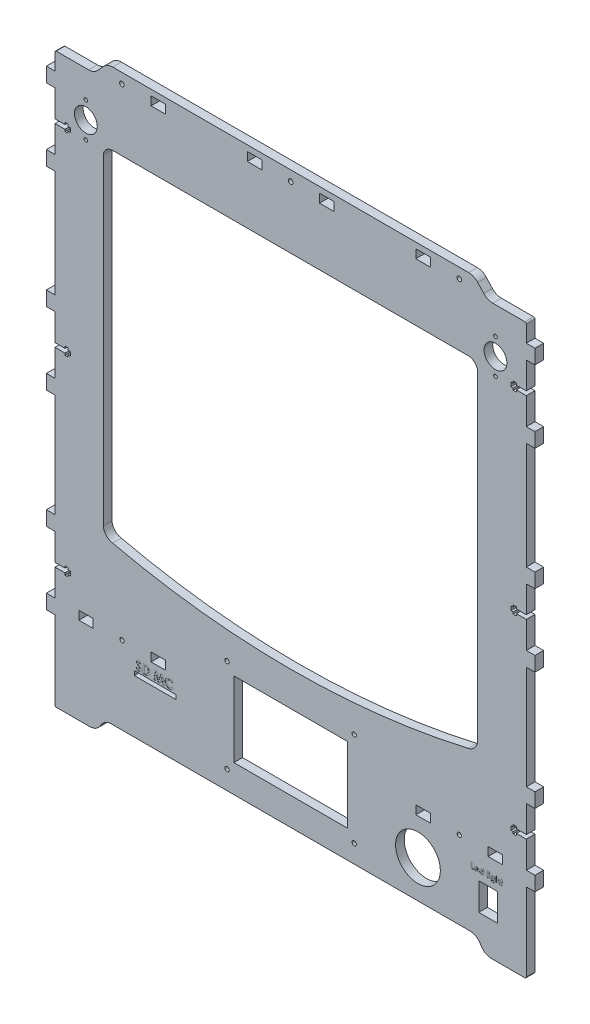
from build123d import *

# Parameters (mm, degrees)
SKETCH_1_R          = 1.5
SKETCH_1_R_2        = 15.5
SKETCH_1_R_3        = 1.6
SKETCH_1_R_4        = 7.9
SKETCH_1_R_5        = 1.25
SKETCH_1_W          = 10
SKETCH_1_H          = 6
SKETCH_1_W_2        = 78.6
SKETCH_1_H_2        = 51.99959895
SKETCH_1_W_3        = 13
SKETCH_1_H_3        = 19
SKETCH_1_W_4        = 29
SKETCH_1_H_4        = 3
EXTRUDE_2_DEPTH     = 6
CUT_EXTRUDE_2_DEPTH = 0.1
SKETCH_4_W          = 0.717948718
SKETCH_4_H          = 4.102564103
SKETCH_4_H_2        = 2.923076923
CUT_EXTRUDE_3_DEPTH = 0.1


with BuildPart() as part:
    # Эскиз1 → Бобышка-Вытянуть2 (new body)
    with BuildSketch(Plane.XY):
        with BuildLine():
            Line((-162.349245127, -146.930877786), (-168.354558228, -146.930877786))
            Line((-168.354558228, -146.930877786), (-168.354558228, -136.930877786))
            Line((-168.354558228, -136.930877786), (-162.354558228, -136.930877786))
            Line((-162.354558228, -136.930877786), (-162.354558228, -118.320877786))
            Line((-162.354558228, -118.320877786), (-155.442615928, -118.320877786))
            Line((-155.442615928, -118.320877786), (-155.442615928, -119.72098181))
            Line((-155.442615928, -119.72098181), (-153.241793345, -119.72098181))
            Line((-153.241793345, -119.72098181), (-153.241793345, -118.321100605))
            Line((-153.241793345, -118.321100605), (-151.743644127, -118.321100605))
            Line((-151.743644127, -118.321100605), (-151.743644127, -115.521795283))
            Line((-151.743644127, -115.521795283), (-153.245115684, -115.521795283))
            Line((-153.245115684, -115.521795283), (-153.245115684, -114.120877786))
            Line((-153.245115684, -114.120877786), (-155.445116095, -114.120877786))
            Line((-155.445116095, -114.120877786), (-155.445116095, -115.520877786))
            Line((-155.445116095, -115.520877786), (-162.354558228, -115.520877786))
            Line((-162.354558228, -115.520877786), (-162.354558228, -96.940877786))
            Line((-162.354558228, -96.940877786), (-168.354558228, -96.940877786))
            Line((-168.354558228, -96.940877786), (-168.354558228, -86.940877786))
            Line((-168.354558228, -86.940877786), (-162.354558228, -86.940877786))
            Line((-162.354558228, -86.940877786), (-162.354558228, -15.210877786))
            Line((-162.354558228, -15.210877786), (-168.354558228, -15.210877786))
            Line((-168.354558228, -15.210877786), (-168.354558228, -5.210877786))
            Line((-168.354558228, -5.210877786), (-162.354558228, -5.210877786))
            Line((-162.354558228, -5.210877786), (-162.354558228, 13.389122214))
            Line((-162.354558228, 13.389122214), (-155.444055652, 13.389122214))
            Line((-155.444055652, 13.389122214), (-155.444055652, 11.989017706))
            Line((-155.444055652, 11.989017706), (-153.243233069, 11.989017706))
            Line((-153.243233069, 11.989017706), (-153.243233069, 13.362239479))
            Line((-153.243233069, 13.362239479), (-151.742761748, 13.362239479))
            Line((-151.742761748, 13.362239479), (-151.742761748, 16.188530845))
            Line((-151.742761748, 16.188530845), (-153.245115684, 16.188530845))
            Line((-153.245115684, 16.188530845), (-153.245115684, 17.589122214))
            Line((-153.245115684, 17.589122214), (-155.445116095, 17.589122214))
            Line((-155.445116095, 17.589122214), (-155.445116095, 16.189122214))
            Line((-155.445116095, 16.189122214), (-162.354558228, 16.189122214))
            Line((-162.354558228, 16.189122214), (-162.354558228, 34.789122214))
            Line((-162.354558228, 34.789122214), (-168.354558228, 34.789122214))
            Line((-168.354558228, 34.789122214), (-168.354558228, 44.789122214))
            Line((-168.354558228, 44.789122214), (-162.354558228, 44.789122214))
            Line((-162.354558228, 44.789122214), (-162.354558228, 118.949122214))
            Line((-162.354558228, 118.949122214), (-168.354558228, 118.949122214))
            Line((-168.354558228, 118.949122214), (-168.354558228, 128.949122214))
            Line((-168.354558228, 128.949122214), (-162.354558228, 128.949122214))
            Line((-162.354558228, 128.949122214), (-162.354558228, 147.549122214))
            Line((-162.354558228, 147.549122214), (-155.444087484, 147.549122214))
            Line((-155.444087484, 147.549122214), (-155.444087484, 146.149017702))
            Line((-155.444087484, 146.149017702), (-153.243264902, 146.149017702))
            Line((-153.243264902, 146.149017702), (-153.243264902, 147.548898907))
            Line((-153.243264902, 147.548898907), (-151.737469071, 147.548898907))
            Line((-151.737469071, 147.548898907), (-151.737951164, 150.348204717))
            Line((-151.737951164, 150.348204717), (-153.239802583, 150.348204717))
            Line((-153.239802583, 150.348204717), (-153.239802583, 151.749122214))
            Line((-153.239802583, 151.749122214), (-155.439802995, 151.749122214))
            Line((-155.439802995, 151.749122214), (-155.439802995, 150.349122214))
            Line((-155.439802995, 150.349122214), (-162.349245127, 150.349122214))
            Line((-162.349245127, 150.349122214), (-162.349245127, 168.949122214))
            Line((-162.349245127, 168.949122214), (-168.349245127, 168.949122214))
            Line((-168.349245127, 168.949122214), (-168.349245127, 178.949122214))
            Line((-168.349245127, 178.949122214), (-162.349245127, 178.949122214))
            Line((-162.349245127, 178.949122214), (-162.349245127, 190.349122214))
            ThreePointArc((-162.349245127, 190.349122214), (-162.144381362, 191.019766001), (-161.525304034, 191.349122214))
            Line((-161.525304034, 191.349122214), (-139.092392644, 191.349122214))
            ThreePointArc((-139.092392644, 191.349122214), (-135.666701236, 192.070006687), (-132.82207518, 194.110383773))
            Line((-132.82207518, 194.110383773), (-128.724185584, 198.587860655))
            ThreePointArc((-128.724185584, 198.587860655), (-125.879559527, 200.62823774), (-122.453868119, 201.349122214))
            Line((-122.453868119, 201.349122214), (123.955377865, 201.349122214))
            ThreePointArc((123.955377865, 201.349122214), (127.381069274, 200.62823774), (130.22569533, 198.587860655))
            Line((130.22569533, 198.587860655), (134.323584926, 194.110383773))
            ThreePointArc((134.323584926, 194.110383773), (137.168210982, 192.070006687), (140.59390239, 191.349122214))
            Line((140.59390239, 191.349122214), (162.850754873, 191.349122214))
            ThreePointArc((162.850754873, 191.349122214), (163.557861654, 191.056228995), (163.850754873, 190.349122214))
            Line((163.850754873, 190.349122214), (163.850754873, 178.949122214))
            Line((163.850754873, 178.949122214), (169.850754873, 178.949122214))
            Line((169.850754873, 178.949122214), (169.850754873, 168.949122214))
            Line((169.850754873, 168.949122214), (163.850754873, 168.949122214))
            Line((163.850754873, 168.949122214), (163.850754873, 150.349122214))
            Line((163.850754873, 150.349122214), (156.938753666, 150.349122214))
            Line((156.938753666, 150.349122214), (156.938753666, 151.74917383))
            Line((156.938753666, 151.74917383), (154.741012446, 151.74917383))
            Line((154.741012446, 151.74917383), (154.741012446, 150.349292624))
            Line((154.741012446, 150.349292624), (153.241012446, 150.349292624))
            Line((153.241012446, 150.349292624), (153.241012446, 147.550209336))
            Line((153.241012446, 147.550209336), (154.741012446, 147.550209336))
            Line((154.741012446, 147.550209336), (154.741012446, 146.149291839))
            Line((154.741012446, 146.149291839), (156.941736218, 146.149291839))
            Line((156.941736218, 146.149291839), (156.941736218, 147.549122214))
            Line((156.941736218, 147.549122214), (163.851237257, 147.549122214))
            Line((163.851237257, 147.549122214), (163.851237257, 128.949122214))
            Line((163.851237257, 128.949122214), (169.851237081, 128.949122214))
            Line((169.851237081, 128.949122214), (169.851237081, 118.949122214))
            Line((169.851237081, 118.949122214), (163.851237081, 118.949122214))
            Line((163.851237081, 118.949122214), (163.851237081, 44.789122214))
            Line((163.851237081, 44.789122214), (169.851237081, 44.789122214))
            Line((169.851237081, 44.789122214), (169.851237081, 34.789122214))
            Line((169.851237081, 34.789122214), (163.851237081, 34.789122214))
            Line((163.851237081, 34.789122214), (163.851237081, 16.189122214))
            Line((163.851237081, 16.189122214), (156.939202586, 16.189122214))
            Line((156.939202586, 16.189122214), (156.939202586, 17.562103605))
            Line((156.939202586, 17.562103605), (154.739101533, 17.562103605))
            Line((154.739101533, 17.562103605), (154.739101533, 16.189291862))
            Line((154.739101533, 16.189291862), (153.239956889, 16.189291862))
            Line((153.239956889, 16.189291862), (153.239956889, 13.39020884))
            Line((153.239956889, 13.39020884), (154.741461365, 13.39020884))
            Line((154.741461365, 13.39020884), (154.741461365, 11.989291851))
            Line((154.741461365, 11.989291851), (156.941702753, 11.989291851))
            Line((156.941702753, 11.989291851), (156.941702753, 13.389122214))
            Line((156.941702753, 13.389122214), (163.851237081, 13.389122214))
            Line((163.851237081, 13.389122214), (163.851237081, -5.210877786))
            Line((163.851237081, -5.210877786), (169.851237081, -5.210877786))
            Line((169.851237081, -5.210877786), (169.851237081, -15.210877786))
            Line((169.851237081, -15.210877786), (163.851237081, -15.210877786))
            Line((163.851237081, -15.210877786), (163.851237081, -86.940877786))
            Line((163.851237081, -86.940877786), (169.851237081, -86.940877786))
            Line((169.851237081, -86.940877786), (169.851237081, -96.940877786))
            Line((169.851237081, -96.940877786), (163.939237081, -96.940877786))
            Line((163.939237081, -96.940877786), (163.939237081, -115.520877786))
            Line((163.939237081, -115.520877786), (156.93923577, -115.520877786))
            Line((156.93923577, -115.520877786), (156.93923577, -114.122358317))
            Line((156.93923577, -114.122358317), (154.738205666, -114.122358317))
            Line((154.738205666, -114.122358317), (154.738205666, -115.522239523))
            Line((154.738205666, -115.522239523), (153.238413576, -115.522239523))
            Line((153.238413576, -115.522239523), (153.238413576, -118.322187164))
            Line((153.238413576, -118.322187164), (154.740539372, -118.322187164))
            Line((154.740539372, -118.322187164), (154.740539372, -119.723103854))
            Line((154.740539372, -119.723103854), (156.939923762, -119.723103854))
            Line((156.939923762, -119.723103854), (156.939923762, -118.320877786))
            Line((156.939923762, -118.320877786), (163.851344603, -118.320877786))
            Line((163.851344603, -118.320877786), (163.851344603, -136.930877786))
            Line((163.851344603, -136.930877786), (169.845441772, -136.930877786))
            Line((169.845441772, -136.930877786), (169.845441772, -146.930877786))
            Line((169.845441772, -146.930877786), (163.845441772, -146.930877786))
            Line((163.845441772, -146.930877786), (163.845441772, -200.973061911))
            ThreePointArc((163.845441772, -200.973061911), (163.501928515, -201.680136073), (162.762754873, -201.947675896))
            Line((162.762754873, -201.947675896), (139.726369967, -201.947675896))
            ThreePointArc((139.726369967, -201.947675896), (136.178541077, -201.14298723), (133.302992201, -198.914572468))
            Line((133.302992201, -198.914572468), (131.246288055, -195.894919373))
            ThreePointArc((131.246288055, -195.894919373), (128.327165513, -193.654997866), (124.734910288, -192.858614055))
            Line((124.734910288, -192.858614055), (-123.233400542, -192.858614055))
            ThreePointArc((-123.233400542, -192.858614055), (-126.825655767, -193.654997866), (-129.744778309, -195.894919373))
            Line((-129.744778309, -195.894919373), (-131.801482455, -198.914572469))
            ThreePointArc((-131.801482455, -198.914572469), (-134.720604996, -201.154493976), (-138.312860221, -201.950877786))
            Line((-138.312860221, -201.950877786), (-161.437304034, -201.950877786))
            ThreePointArc((-161.437304034, -201.950877786), (-162.093143033, -201.646865801), (-162.349245127, -200.970877786))
            Line((-162.349245127, -200.970877786), (-162.349245127, -146.930877786))
        make_face()
        with Locations((44.745441772, -115.136083352)):
            Circle(SKETCH_1_R, mode=Mode.SUBTRACT)
        with Locations((44.745441772, -180.385682302)):
            Circle(SKETCH_1_R, mode=Mode.SUBTRACT)
        with Locations((-43.254558228, -179.882480412)):
            Circle(SKETCH_1_R, mode=Mode.SUBTRACT)
        with Locations((-43.254558228, -115.136083352)):
            Circle(SKETCH_1_R, mode=Mode.SUBTRACT)
        with Locations((88.845441772, -166.947675896)):
            Circle(SKETCH_1_R_2, mode=Mode.SUBTRACT)
        with Locations((0.750754873, 194.349122214)):
            Circle(SKETCH_1_R_3, mode=Mode.SUBTRACT)
        with Locations((-116.049245127, 194.349122214)):
            Circle(SKETCH_1_R_3, mode=Mode.SUBTRACT)
        with Locations((117.550754873, 194.349122214)):
            Circle(SKETCH_1_R_3, mode=Mode.SUBTRACT)
        with Locations((-140.999245127, 160.349122214)):
            Circle(SKETCH_1_R_4, mode=Mode.SUBTRACT)
        with Locations((142.500754873, 160.349122214)):
            Circle(SKETCH_1_R_4, mode=Mode.SUBTRACT)
        with Locations((-115.994558228, -138.947675896)):
            Circle(SKETCH_1_R, mode=Mode.SUBTRACT)
        with Locations((117.485441772, -138.947675896)):
            Circle(SKETCH_1_R, mode=Mode.SUBTRACT)
        with Locations((-140.999245127, 172.349122214)):
            Circle(SKETCH_1_R_5, mode=Mode.SUBTRACT)
        with Locations((-140.999245127, 148.349122214)):
            Circle(SKETCH_1_R_5, mode=Mode.SUBTRACT)
        with Locations((142.500754873, 172.349122214)):
            Circle(SKETCH_1_R_5, mode=Mode.SUBTRACT)
        with Locations((142.500754873, 148.349122214)):
            Circle(SKETCH_1_R_5, mode=Mode.SUBTRACT)
        with Locations((-90.889245127, 194.349122214)):
            Rectangle(SKETCH_1_W, SKETCH_1_H, mode=Mode.SUBTRACT)
        with Locations((92.390754873, 194.349122214)):
            Rectangle(SKETCH_1_W, SKETCH_1_H, mode=Mode.SUBTRACT)
        with Locations((92.365441772, -138.947675896)):
            Rectangle(SKETCH_1_W, SKETCH_1_H, mode=Mode.SUBTRACT)
        with Locations((142.385441772, -138.947675896)):
            Rectangle(SKETCH_1_W, SKETCH_1_H, mode=Mode.SUBTRACT)
        with Locations((-140.894558228, -138.947675896)):
            Rectangle(SKETCH_1_W, SKETCH_1_H, mode=Mode.SUBTRACT)
        with Locations((-90.874558228, -138.947675896)):
            Rectangle(SKETCH_1_W, SKETCH_1_H, mode=Mode.SUBTRACT)
        with Locations((-24.239245127, 194.349122214)):
            Rectangle(SKETCH_1_W, SKETCH_1_H, mode=Mode.SUBTRACT)
        with Locations((25.740754873, 194.349122214)):
            Rectangle(SKETCH_1_W, SKETCH_1_H, mode=Mode.SUBTRACT)
        with BuildLine():
            Line((-122.399111136, 151.349122214), (123.624117201, 151.349122214))
            ThreePointArc((123.624117201, 151.349122214), (128.051771635, 149.629783996), (130.158760923, 145.372925549))
            Line((130.158760923, 145.372925549), (130.125352868, -76.974184913))
            ThreePointArc((130.125352868, -76.974184913), (127.977308293, -81.497473491), (123.648924914, -84.015276578))
            ThreePointArc((123.648924914, -84.015276578), (0.588905308, -98.015276578), (-122.471114299, -84.015276578))
            ThreePointArc((-122.471114299, -84.015276578), (-126.930378694, -81.617835611), (-128.947210492, -76.974006197))
            Line((-128.947210492, -76.974006197), (-128.934108856, 145.37292555))
            ThreePointArc((-128.934108856, 145.37292555), (-126.846261851, 149.650978449), (-122.399111136, 151.349122214))
        make_face(mode=Mode.SUBTRACT)
        with Locations((0.745441772, -147.635882827)):
            Rectangle(SKETCH_1_W_2, SKETCH_1_H_2, mode=Mode.SUBTRACT)
        with Locations((137.438754873, -169.176180946)):
            Rectangle(SKETCH_1_W_3, SKETCH_1_H_3, mode=Mode.SUBTRACT)
        with Locations((-93.004246156, -154.427084063)):
            Rectangle(SKETCH_1_W_4, SKETCH_1_H_4, mode=Mode.SUBTRACT)
    extrude(amount=EXTRUDE_2_DEPTH)

    # Эскиз3 → Вырез-Вытянуть2 (cut)
    # profile 1 of 4: a face of its own
    with BuildSketch(Plane.XY.offset(6)):
        with BuildLine():
            Line((-102.674574939, -146.373531508), (-103.4798634, -147.110310354))
            add(Edge.make_bspline(
                [(-103.4798634, -147.110310354), (-103.514358505, -147.061651423), (-103.580584295, -146.96823306), (-103.687929394, -146.843143671), (-103.794789775, -146.736433113), (-103.902155434, -146.648547174), (-104.01097802, -146.580019826), (-104.121068632, -146.531501706), (-104.231803136, -146.500658277), (-104.306199629, -146.496817528), (-104.342844169, -146.494925739)],
                knots=[0, 0, 0, 0, 1.299362458, 2.494594718, 3.587462134, 4.587049575, 5.512617175, 6.380583204, 7.202344345, 8, 8, 8, 8], degree=3))
            add(Edge.make_bspline(
                [(-104.342844169, -146.494925739), (-104.377025145, -146.496124463), (-104.443019629, -146.498438885), (-104.537099662, -146.521444066), (-104.620625255, -146.56114763), (-104.693514891, -146.61306338), (-104.751254237, -146.675609823), (-104.797354627, -146.741204959), (-104.82331302, -146.813607155), (-104.826729655, -146.863335904), (-104.828421093, -146.887954585)],
                knots=[0, 0, 0, 0, 1.185010067, 2.2879431, 3.333075148, 4.379039566, 5.372662701, 6.27520591, 7.14612461, 8, 8, 8, 8], degree=3))
            add(Edge.make_bspline(
                [(-104.828421093, -146.887954585), (-104.827361155, -146.912928278), (-104.825226587, -146.963221825), (-104.804609569, -147.036933281), (-104.773533836, -147.108957955), (-104.743839704, -147.152802801), (-104.728661477, -147.1752142)],
                knots=[0, 0, 0, 0, 0.967525499, 1.948461899, 2.951351359, 4, 4, 4, 4], degree=3))
            add(Edge.make_bspline(
                [(-104.728661477, -147.1752142), (-104.714862827, -147.192634346), (-104.683100157, -147.232733221), (-104.622535249, -147.296243588), (-104.546478446, -147.374049347), (-104.45200292, -147.463474985), (-104.34303061, -147.567736599), (-104.21451051, -147.682735625), (-104.070141987, -147.812033448), (-103.967528186, -147.902071771), (-103.913757631, -147.949252662)],
                knots=[0, 0, 0, 0, 0.473873513, 1.090794244, 1.870441696, 2.795289791, 3.865433203, 5.087734844, 6.473946851, 8, 8, 8, 8], degree=3))
            add(Edge.make_bspline(
                [(-103.913757631, -147.949252662), (-103.86328623, -147.992933113), (-103.767501997, -148.075829535), (-103.631220055, -148.193487697), (-103.511450925, -148.299341876), (-103.406449845, -148.391803428), (-103.317808528, -148.471842486), (-103.245154327, -148.539841636), (-103.187599893, -148.594477059), (-103.154883567, -148.627476888), (-103.140921093, -148.641560354)],
                knots=[0, 0, 0, 0, 1.543621617, 2.929473131, 4.163658386, 5.240097082, 6.164993805, 6.925417477, 7.541396219, 8, 8, 8, 8], degree=3))
            add(Edge.make_bspline(
                [(-103.140921093, -148.641560354), (-103.087950376, -148.698886014), (-102.986122057, -148.809086063), (-102.853781139, -148.979861483), (-102.744860283, -149.146573115), (-102.660597043, -149.312357908), (-102.596958055, -149.479607807), (-102.552091726, -149.652424607), (-102.525220982, -149.832614135), (-102.522237702, -149.955571491), (-102.520728785, -150.017762277)],
                knots=[0, 0, 0, 0, 1.206664779, 2.319633467, 3.337109185, 4.282041471, 5.190008762, 6.099243693, 7.03861361, 8, 8, 8, 8], degree=3))
            add(Edge.make_bspline(
                [(-102.520728785, -150.017762277), (-102.521802794, -150.078359571), (-102.523910039, -150.197253717), (-102.549719755, -150.371237589), (-102.586522895, -150.537747707), (-102.643427006, -150.694972203), (-102.7127814, -150.84549187), (-102.799727149, -150.986962091), (-102.901833009, -151.120814601), (-103.018862003, -151.244656624), (-103.148309966, -151.357034676), (-103.287155209, -151.457076272), (-103.436755431, -151.539673353), (-103.59583247, -151.607686157), (-103.764301177, -151.660070529), (-103.941960855, -151.698787461), (-104.129083245, -151.722024754), (-104.257040232, -151.724453937), (-104.322411477, -151.725694969)],
                knots=[0, 0, 0, 0, 1.043214005, 2.046824704, 3.02475056, 3.976699089, 4.921714032, 5.875962561, 6.831408892, 7.817874052, 8.806269674, 9.781291748, 10.760897367, 11.74438705, 12.757449933, 13.795994037, 14.874007457, 16, 16, 16, 16], degree=3))
            add(Edge.make_bspline(
                [(-104.322411477, -151.725694969), (-104.373727348, -151.724784592), (-104.475362201, -151.722981522), (-104.625156609, -151.708260956), (-104.769800044, -151.684503529), (-104.909129576, -151.650452039), (-105.043772912, -151.607304183), (-105.173735579, -151.55460073), (-105.298120403, -151.491524796), (-105.417868538, -151.419373473), (-105.532397861, -151.335596283), (-105.643156549, -151.241906023), (-105.749044443, -151.136861695), (-105.8505701, -151.020711725), (-105.947083931, -150.893127204), (-106.04174518, -150.755884983), (-106.130346816, -150.606438032), (-106.185079988, -150.501599787), (-106.213036477, -150.448050739)],
                knots=[0, 0, 0, 0, 1.016823716, 2.013894106, 2.979844003, 3.91962641, 4.853723003, 5.779685073, 6.695824784, 7.614987388, 8.547259901, 9.504950863, 10.487499108, 11.500346958, 12.559593716, 13.656357062, 14.802919212, 16, 16, 16, 16], degree=3))
            Line((-106.213036477, -150.448050739), (-105.265921093, -149.879541123))
            add(Edge.make_bspline(
                [(-105.265921093, -149.879541123), (-105.230951703, -149.94032629), (-105.163912394, -150.056856649), (-105.050308018, -150.213429956), (-104.933926135, -150.347509076), (-104.812076099, -150.456724151), (-104.686239562, -150.542535528), (-104.555808703, -150.603862292), (-104.420691885, -150.641823489), (-104.328656447, -150.646459428), (-104.282748016, -150.648771892)],
                knots=[0, 0, 0, 0, 1.283663364, 2.460892379, 3.537111102, 4.529833553, 5.449777664, 6.316464042, 7.160231139, 8, 8, 8, 8], degree=3))
            add(Edge.make_bspline(
                [(-104.282748016, -150.648771892), (-104.236052568, -150.646883409), (-104.1454566, -150.643219475), (-104.016142448, -150.609376822), (-103.897582337, -150.556241376), (-103.795099852, -150.480424421), (-103.708324146, -150.392920131), (-103.644278694, -150.295567608), (-103.604044909, -150.190234527), (-103.599791222, -150.117063241), (-103.597651862, -150.080262277)],
                knots=[0, 0, 0, 0, 1.13588714, 2.203786484, 3.234766741, 4.283437687, 5.291419208, 6.222934724, 7.106237994, 8, 8, 8, 8], degree=3))
            add(Edge.make_bspline(
                [(-103.597651862, -150.080262277), (-103.599627474, -150.046024969), (-103.60364074, -149.976475154), (-103.633201225, -149.873065763), (-103.679413278, -149.769703401), (-103.734085396, -149.684922796), (-103.789721121, -149.613938292), (-103.842921424, -149.552433432), (-103.907705319, -149.484481328), (-103.983908544, -149.409996503), (-104.070524254, -149.328323247), (-104.167625413, -149.239469559), (-104.276323932, -149.144218134), (-104.353152259, -149.079333804), (-104.393324939, -149.045406508)],
                knots=[0, 0, 0, 0, 0.916159276, 1.861089862, 2.860218735, 3.940849679, 4.552606315, 5.27541173, 6.11797699, 7.06649574, 8.129236253, 9.306560635, 10.591630461, 12, 12, 12, 12], degree=3))
            add(Edge.make_bspline(
                [(-104.393324939, -149.045406508), (-104.469694801, -148.980790281), (-104.616271683, -148.856772184), (-104.823403412, -148.673601358), (-105.010047647, -148.502411438), (-105.174592327, -148.341086142), (-105.319134006, -148.192604773), (-105.442693785, -148.05576131), (-105.543914302, -147.929500192), (-105.650427071, -147.779952348), (-105.751635498, -147.597718023), (-105.839108299, -147.378469005), (-105.89585696, -147.159247807), (-105.902214859, -147.012074769), (-105.905344169, -146.939637277)],
                knots=[0, 0, 0, 0, 1.345494975, 2.582412109, 3.71882943, 4.751509156, 5.681369928, 6.505683931, 7.230279997, 7.856715994, 8.973648664, 10.023341002, 11.027102913, 12, 12, 12, 12], degree=3))
            add(Edge.make_bspline(
                [(-105.905344169, -146.939637277), (-105.904042693, -146.888268496), (-105.901478645, -146.787066479), (-105.878606941, -146.638263658), (-105.844424308, -146.49468144), (-105.794781312, -146.356843676), (-105.730350696, -146.224923014), (-105.652102216, -146.098273648), (-105.558820822, -145.978061229), (-105.453698987, -145.86436545), (-105.33788164, -145.760460446), (-105.214116086, -145.668753869), (-105.083102849, -145.59129716), (-104.945643403, -145.527041196), (-104.800885967, -145.477857337), (-104.649896964, -145.442993367), (-104.492459828, -145.422257389), (-104.385374486, -145.419438574), (-104.330824939, -145.418002662)],
                knots=[0, 0, 0, 0, 1.010766082, 1.991317756, 2.957454644, 3.913069143, 4.869106762, 5.843196583, 6.838735724, 7.860187025, 8.887984031, 9.89767229, 10.887916223, 11.879572884, 12.879850636, 13.892031539, 14.926195476, 16, 16, 16, 16], degree=3))
            add(Edge.make_bspline(
                [(-104.330824939, -145.418002662), (-104.260131426, -145.420588781), (-104.119302429, -145.425740606), (-103.911082697, -145.466026192), (-103.707702367, -145.529379519), (-103.543814686, -145.605808338), (-103.413412318, -145.679844972), (-103.313471083, -145.748008577), (-103.211775498, -145.826093651), (-103.10750545, -145.91434626), (-103.002598438, -146.014429199), (-102.894071453, -146.123959915), (-102.78340331, -146.243885009), (-102.711486564, -146.32955894), (-102.674574939, -146.373531508)],
                knots=[0, 0, 0, 0, 1.282922637, 2.555718331, 3.837320111, 5.142675274, 5.830281639, 6.55870424, 7.337177975, 8.157850921, 9.037902056, 9.96903443, 10.957596896, 12, 12, 12, 12], degree=3))
        make_face()
    # profile 2 of 4: a face of its own
    with BuildSketch(Plane.XY.offset(6)):
        with BuildLine():
            Line((-101.443805708, -145.571848816), (-100.086834554, -145.571848816))
            add(Edge.make_bspline(
                [(-100.086834554, -145.571848816), (-99.981043045, -145.572588334), (-99.776546861, -145.574017833), (-99.480272347, -145.590124841), (-99.204774751, -145.614896276), (-98.949876481, -145.648973874), (-98.71610012, -145.694067869), (-98.503747118, -145.750629447), (-98.312104767, -145.815920379), (-98.139071749, -145.892748409), (-97.981109247, -145.982322262), (-97.831118809, -146.082100344), (-97.689394939, -146.195737815), (-97.553948766, -146.321042385), (-97.426528253, -146.46030646), (-97.30501139, -146.611223323), (-97.192373462, -146.775981478), (-97.085209669, -146.950630542), (-96.988294277, -147.135910663), (-96.903761051, -147.330244774), (-96.832947055, -147.532382263), (-96.775407017, -147.742538556), (-96.729540965, -147.960015998), (-96.697449413, -148.185253438), (-96.677610096, -148.418042344), (-96.675597563, -148.575814815), (-96.674574939, -148.655983431)],
                knots=[0, 0, 0, 0, 1.44355588, 2.790409838, 4.047694926, 5.217575253, 6.298404546, 7.294384826, 8.214239204, 9.058592145, 9.873746385, 10.689560431, 11.514393297, 12.350027578, 13.205127629, 14.088021785, 14.991911688, 15.926770944, 16.882954281, 17.842803888, 18.816321264, 19.80318086, 20.814351908, 21.847355356, 22.906180909, 24, 24, 24, 24], degree=3))
            add(Edge.make_bspline(
                [(-96.674574939, -148.655983431), (-96.677252721, -148.769106566), (-96.682524093, -148.991796079), (-96.726927185, -149.318590374), (-96.798742019, -149.6318553), (-96.899720199, -149.929140377), (-97.024906111, -150.207798237), (-97.1744547, -150.462914867), (-97.346173237, -150.693120928), (-97.538061191, -150.897270185), (-97.74582911, -151.072739237), (-97.961741875, -151.22301564), (-98.187902869, -151.341521123), (-98.387182312, -151.416671321), (-98.55998245, -151.463408242), (-98.711699102, -151.491030212), (-98.884033738, -151.516361225), (-99.07859323, -151.535936487), (-99.294524087, -151.55339281), (-99.532687012, -151.562877896), (-99.792310901, -151.570758595), (-99.97264424, -151.571475887), (-100.066401862, -151.571848816)],
                knots=[0, 0, 0, 0, 1.315458931, 2.589557908, 3.828601765, 5.048913369, 6.235739168, 7.376350998, 8.481830359, 9.569842114, 10.627874879, 11.640079404, 12.624025415, 13.590060155, 14.111227486, 14.704434459, 15.382649715, 16.137166398, 16.978595427, 17.902333227, 18.909396075, 20, 20, 20, 20], degree=3))
            Line((-100.066401862, -151.571848816), (-101.443805708, -151.571848816))
            Line((-101.443805708, -151.571848816), (-101.443805708, -145.571848816))
        make_face()
        with BuildLine():
            Line((-100.366882631, -146.648771892), (-100.366882631, -150.494925739))
            Line((-100.366882631, -150.494925739), (-99.804382631, -150.494925739))
            add(Edge.make_bspline(
                [(-99.804382631, -150.494925739), (-99.73745377, -150.494803097), (-99.608727289, -150.494567217), (-99.422875388, -150.483332039), (-99.251009505, -150.472055019), (-99.093602745, -150.450650857), (-98.949509551, -150.426808127), (-98.820709385, -150.393627703), (-98.704547118, -150.358774479), (-98.602441648, -150.314402005), (-98.508921357, -150.264457832), (-98.422332249, -150.205942444), (-98.338749517, -150.140963312), (-98.259735808, -150.067609308), (-98.184992073, -149.986851776), (-98.114960544, -149.898274609), (-98.048706484, -149.802148058), (-97.987930512, -149.697963879), (-97.932393102, -149.58682228), (-97.883125196, -149.469799829), (-97.842274833, -149.345921981), (-97.808322511, -149.216348382), (-97.784059728, -149.079950947), (-97.763986902, -148.937739953), (-97.753638776, -148.789151972), (-97.75221856, -148.688047743), (-97.751498016, -148.636752662)],
                knots=[0, 0, 0, 0, 1.50275155, 2.890291501, 4.180787663, 5.369391935, 6.45668281, 7.458360028, 8.354766181, 9.177074746, 9.954075863, 10.732690366, 11.5210699, 12.329727389, 13.151100085, 13.990027547, 14.863562427, 15.770965086, 16.696477834, 17.652329173, 18.619756807, 19.62365428, 20.657822005, 21.729286259, 22.847956731, 24, 24, 24, 24], degree=3))
            add(Edge.make_bspline(
                [(-97.751498016, -148.636752662), (-97.752933096, -148.558147799), (-97.75573139, -148.404874406), (-97.782717537, -148.181628365), (-97.826645837, -147.971408773), (-97.889327287, -147.774995812), (-97.968339199, -147.591837458), (-98.067241025, -147.423485452), (-98.18177641, -147.26711171), (-98.272347869, -147.175377855), (-98.317603785, -147.129541123)],
                knots=[0, 0, 0, 0, 1.13821349, 2.219428113, 3.251817212, 4.244760574, 5.201143372, 6.134805572, 7.068016741, 8, 8, 8, 8], degree=3))
            add(Edge.make_bspline(
                [(-98.317603785, -147.129541123), (-98.362230403, -147.090482031), (-98.453375219, -147.010708258), (-98.613395563, -146.915118878), (-98.789729694, -146.831134238), (-98.986411609, -146.764543784), (-99.201540464, -146.711881215), (-99.436397572, -146.675561128), (-99.689725221, -146.652222226), (-99.865224713, -146.649946644), (-99.955824939, -146.648771892)],
                knots=[0, 0, 0, 0, 0.813307809, 1.661089106, 2.549956539, 3.493439533, 4.508053171, 5.589449661, 6.755572447, 8, 8, 8, 8], degree=3))
            Line((-99.955824939, -146.648771892), (-100.366882631, -146.648771892))
        make_face(mode=Mode.SUBTRACT)
    # profile 3 of 4: a face of its own
    with BuildSketch(Plane.XY.offset(6)):
        Polygon((-92.815199939, -145.571848816), (-91.697411477, -145.571848816), (-90.328421093, -149.756944969), (-88.949815323, -145.571848816), (-87.842844169, -145.571848816), (-86.828421093, -151.571848816), (-87.918565323, -151.571848816), (-88.559190323, -147.782185354), (-89.806786477, -151.571848816), (-90.857267246, -151.571848816), (-92.097651862, -147.782185354), (-92.737074939, -151.571848816), (-93.828421093, -151.571848816), align=None)
    # profile 4 of 4: a face of its own
    with BuildSketch(Plane.XY.offset(6)):
        with BuildLine():
            Line((-80.443805708, -146.6127142), (-81.233469169, -147.367521892))
            add(Edge.make_bspline(
                [(-81.233469169, -147.367521892), (-81.300454858, -147.298258579), (-81.431298892, -147.162965628), (-81.642137872, -146.983849683), (-81.861402735, -146.834580779), (-82.084828119, -146.708867458), (-82.316432801, -146.613756371), (-82.553538799, -146.54444732), (-82.797660105, -146.502192211), (-82.962872016, -146.497357479), (-83.045969169, -146.494925739)],
                knots=[0, 0, 0, 0, 1.115251505, 2.178435587, 3.19620269, 4.182487026, 5.141301733, 6.088180966, 7.038406374, 8, 8, 8, 8], degree=3))
            add(Edge.make_bspline(
                [(-83.045969169, -146.494925739), (-83.115365391, -146.496846899), (-83.252311188, -146.500638096), (-83.453383505, -146.528431314), (-83.645719568, -146.575694889), (-83.829977774, -146.640832852), (-84.005615934, -146.725117918), (-84.173002297, -146.828484853), (-84.331724178, -146.950000108), (-84.479684953, -147.089034955), (-84.61503427, -147.240940974), (-84.734624009, -147.403024334), (-84.834799599, -147.574913711), (-84.917012077, -147.754868336), (-84.981052419, -147.943721127), (-85.026785269, -148.141344942), (-85.053235927, -148.347975135), (-85.057183865, -148.488440801), (-85.059190323, -148.559829585)],
                knots=[0, 0, 0, 0, 1.035432265, 2.043311493, 3.022114605, 3.98653278, 4.95457646, 5.923598177, 6.917315552, 7.932509744, 8.948865224, 9.949768934, 10.933144597, 11.912367597, 12.897413939, 13.903909035, 14.934704909, 16, 16, 16, 16], degree=3))
            add(Edge.make_bspline(
                [(-85.059190323, -148.559829585), (-85.058612085, -148.609935228), (-85.057472365, -148.70869448), (-85.044996117, -148.854786824), (-85.024906416, -148.996530935), (-84.995831641, -149.133712109), (-84.959473349, -149.266449229), (-84.916816794, -149.39588741), (-84.863304774, -149.520238109), (-84.803905623, -149.640945579), (-84.734825096, -149.754716164), (-84.660343543, -149.863205859), (-84.57958046, -149.965882858), (-84.492012739, -150.062327415), (-84.396407973, -150.151032317), (-84.295237192, -150.234665026), (-84.186793784, -150.311131932), (-84.073330394, -150.382352056), (-83.953866842, -150.444221584), (-83.831644451, -150.500263424), (-83.704810083, -150.545777729), (-83.574908023, -150.582466412), (-83.442402494, -150.613664657), (-83.305997471, -150.632874376), (-83.166875412, -150.647421671), (-83.072852252, -150.648319881), (-83.025536477, -150.648771892)],
                knots=[0, 0, 0, 0, 1.103660481, 2.175337485, 3.227646561, 4.255952547, 5.262355991, 6.258840057, 7.255597736, 8.242457506, 9.22035537, 10.185017736, 11.140346927, 12.096287581, 13.051739095, 14.01125915, 14.986044842, 15.97314143, 16.960198552, 17.947847494, 18.933482797, 19.925264591, 20.920966487, 21.929612487, 22.958107872, 24, 24, 24, 24], degree=3))
            add(Edge.make_bspline(
                [(-83.025536477, -150.648771892), (-82.945280791, -150.646450472), (-82.787599237, -150.641889485), (-82.556178885, -150.60622321), (-82.335658344, -150.547554206), (-82.159463487, -150.478269522), (-82.02141947, -150.409849996), (-81.916328601, -150.346565304), (-81.807656452, -150.275774428), (-81.697207974, -150.194805644), (-81.58374084, -150.104630609), (-81.469258009, -150.003274321), (-81.350828697, -149.894074299), (-81.27324683, -149.816136097), (-81.233469169, -149.776175739)],
                knots=[0, 0, 0, 0, 1.404581149, 2.759636711, 4.088442092, 5.392261763, 6.066678138, 6.783632037, 7.538459478, 8.336747902, 9.180226004, 10.074962426, 11.012997595, 12, 12, 12, 12], degree=3))
            Line((-81.233469169, -149.776175739), (-80.467844169, -150.580262277))
            add(Edge.make_bspline(
                [(-80.467844169, -150.580262277), (-80.521663486, -150.632223137), (-80.626707282, -150.733639625), (-80.785162932, -150.877641573), (-80.94341916, -151.007043332), (-81.097652824, -151.126541618), (-81.250390433, -151.232655155), (-81.401615789, -151.325489921), (-81.549616955, -151.407393841), (-81.697467223, -151.476985646), (-81.846086594, -151.536076316), (-81.998998461, -151.586949505), (-82.15667029, -151.629986392), (-82.32006507, -151.664711508), (-82.487658753, -151.692556363), (-82.661019793, -151.711351479), (-82.839048996, -151.72398681), (-82.959808963, -151.725122199), (-83.020728785, -151.725694969)],
                knots=[0, 0, 0, 0, 1.244526981, 2.429050516, 3.560637417, 4.644440555, 5.67424972, 6.652764056, 7.595344123, 8.486817594, 9.369275933, 10.254498637, 11.166417451, 12.086725134, 13.032340136, 13.991389299, 14.986715468, 16, 16, 16, 16], degree=3))
            add(Edge.make_bspline(
                [(-83.020728785, -151.725694969), (-83.132630952, -151.72284236), (-83.351592387, -151.717260596), (-83.672474661, -151.675903507), (-83.977304208, -151.606569075), (-84.266822621, -151.508511064), (-84.54093784, -151.383246551), (-84.799579737, -151.22967814), (-85.042331441, -151.048213837), (-85.267231993, -150.840980582), (-85.470665247, -150.612108849), (-85.650476684, -150.366363395), (-85.799216712, -150.102536474), (-85.922718762, -149.824525651), (-86.01929574, -149.531062254), (-86.087269561, -149.221828846), (-86.12918852, -148.89712401), (-86.133774514, -148.675343122), (-86.1361134, -148.562233431)],
                knots=[0, 0, 0, 0, 1.078019885, 2.10938526, 3.111377082, 4.085535484, 5.04941344, 6.010039228, 6.978205633, 7.964457913, 8.951525778, 9.924444315, 10.892603023, 11.863865945, 12.85144698, 13.863884204, 14.910567087, 16, 16, 16, 16], degree=3))
            add(Edge.make_bspline(
                [(-86.1361134, -148.562233431), (-86.1351251, -148.488464255), (-86.133166531, -148.342271779), (-86.112581787, -148.126918417), (-86.083885457, -147.916987409), (-86.038361338, -147.714658537), (-85.983486503, -147.517206055), (-85.915242437, -147.326776043), (-85.833738133, -147.142821185), (-85.741600668, -146.965033529), (-85.637366476, -146.794577776), (-85.520925441, -146.632918408), (-85.395275209, -146.478807446), (-85.257396609, -146.334289458), (-85.109293199, -146.198095546), (-84.950296308, -146.070963773), (-84.781362224, -145.951070925), (-84.602033704, -145.841508747), (-84.415794624, -145.742403934), (-84.224993949, -145.654989256), (-84.030100453, -145.581930716), (-83.831938165, -145.521331352), (-83.629669852, -145.476098211), (-83.424739252, -145.441858183), (-83.215402652, -145.422717788), (-83.074851261, -145.419584383), (-83.003901862, -145.418002662)],
                knots=[0, 0, 0, 0, 1.071919942, 2.124283339, 3.142214191, 4.149696895, 5.136002878, 6.119640489, 7.086990633, 8.058538607, 9.028339693, 9.988281803, 10.952401235, 11.916291999, 12.888973767, 13.874849856, 14.873389453, 15.898127285, 16.927174885, 17.938320013, 18.946391617, 19.950418109, 20.947802303, 21.956882652, 22.968648068, 24, 24, 24, 24], degree=3))
            add(Edge.make_bspline(
                [(-83.003901862, -145.418002662), (-82.943374749, -145.418909344), (-82.822949838, -145.420713282), (-82.643616937, -145.435751065), (-82.465718256, -145.459367753), (-82.289890728, -145.495000304), (-82.114876655, -145.537300646), (-81.942975916, -145.592687108), (-81.771476686, -145.654425758), (-81.603068674, -145.728221708), (-81.437516809, -145.808776653), (-81.278699402, -145.900169164), (-81.123949926, -145.996775047), (-80.976697534, -146.104311862), (-80.834183873, -146.218879049), (-80.69715416, -146.341011128), (-80.566810909, -146.472744399), (-80.485014722, -146.565821731), (-80.443805708, -146.6127142)],
                knots=[0, 0, 0, 0, 0.996412454, 1.982464992, 2.961075852, 3.949442424, 4.934965278, 5.923860011, 6.921385422, 7.934793307, 8.949617135, 9.951082467, 10.950285876, 11.951772932, 12.951063433, 13.960125323, 14.972308753, 16, 16, 16, 16], degree=3))
        make_face()
    extrude(amount=-CUT_EXTRUDE_2_DEPTH, mode=Mode.SUBTRACT)

    # Эскиз4 → Вырез-Вытянуть3 (cut)
    # profile 1 of 9: a face of its own
    with BuildSketch(Plane.XY.offset(6)):
        Polygon((125.615251261, -150.810391431), (126.333199979, -150.810391431), (126.333199979, -154.092442713), (127.461405107, -154.092442713), (127.461405107, -154.810391431), (125.615251261, -154.810391431), align=None)
    # profile 2 of 9: a face of its own
    with BuildSketch(Plane.XY.offset(6)):
        with BuildLine():
            Line((130.894898697, -153.528340149), (128.589610235, -153.528340149))
            add(Edge.make_bspline(
                [(128.589610235, -153.528340149), (128.594310532, -153.555126293), (128.603546987, -153.607763179), (128.623604276, -153.684222824), (128.649200385, -153.756277103), (128.67987571, -153.824022335), (128.715113065, -153.887816662), (128.756214521, -153.947360864), (128.802658742, -154.002602347), (128.854177201, -154.053301027), (128.909911178, -154.098728143), (128.969590384, -154.138525168), (129.033276405, -154.171156294), (129.100239105, -154.198660947), (129.170978848, -154.220447419), (129.245599746, -154.235473134), (129.32390399, -154.244348879), (129.377247233, -154.245632654), (129.404514081, -154.246288867)],
                knots=[0, 0, 0, 0, 1.091296461, 2.144483647, 3.168565212, 4.157007626, 5.126487748, 6.090021542, 7.05641414, 8.019231907, 8.98705074, 9.938580405, 10.892824166, 11.854447369, 12.841318655, 13.858982407, 14.905600794, 16, 16, 16, 16], degree=3))
            add(Edge.make_bspline(
                [(129.404514081, -154.246288867), (129.437427019, -154.245419933), (129.502242285, -154.243708748), (129.597197133, -154.228533072), (129.689032303, -154.205610882), (129.776878711, -154.171523661), (129.861753918, -154.129091063), (129.94226062, -154.076225267), (130.019792323, -154.014471184), (130.067095798, -153.966871161), (130.091212799, -153.942602969)],
                knots=[0, 0, 0, 0, 1.021034703, 2.010718019, 2.977989445, 3.954245119, 4.929443971, 5.918328161, 6.938689359, 8, 8, 8, 8], degree=3))
            Line((130.091212799, -153.942602969), (130.692174338, -154.228660661))
            add(Edge.make_bspline(
                [(130.692174338, -154.228660661), (130.673253414, -154.254806474), (130.635762301, -154.306613439), (130.574559316, -154.379519219), (130.510690104, -154.447543269), (130.444107031, -154.510238185), (130.374725654, -154.567425312), (130.302738975, -154.619801291), (130.227094937, -154.665959849), (130.14930603, -154.708134108), (130.067764213, -154.744289905), (129.982695148, -154.775122292), (129.894459151, -154.802994508), (129.801941991, -154.82423161), (129.705914058, -154.841042726), (129.606145634, -154.852980846), (129.502649869, -154.860354451), (129.432304401, -154.861228583), (129.396501261, -154.861673482)],
                knots=[0, 0, 0, 0, 1.028154879, 2.037251081, 3.030720504, 4.000128189, 4.949298328, 5.894184978, 6.834267904, 7.770992897, 8.712077017, 9.673380525, 10.653304757, 11.658697181, 12.695551717, 13.758623199, 14.859225354, 16, 16, 16, 16], degree=3))
            add(Edge.make_bspline(
                [(129.396501261, -154.861673482), (129.341418718, -154.860550515), (129.233542733, -154.858351248), (129.075754603, -154.837938905), (128.925899644, -154.804093039), (128.783554718, -154.758084783), (128.649335134, -154.697339472), (128.523174466, -154.623042917), (128.403812189, -154.536619533), (128.294895487, -154.436255522), (128.195669159, -154.327015263), (128.108514921, -154.209698685), (128.035585496, -154.085125433), (127.975694385, -153.95411996), (127.929144934, -153.816346944), (127.895585479, -153.671746262), (127.875013131, -153.52038698), (127.872791216, -153.417294412), (127.871661517, -153.36487861)],
                knots=[0, 0, 0, 0, 1.103565453, 2.161269334, 3.182010356, 4.179077853, 5.15417608, 6.128274628, 7.109042802, 8.101804412, 9.090965879, 10.063106201, 11.02526161, 11.978650795, 12.945248442, 13.93468508, 14.949922959, 16, 16, 16, 16], degree=3))
            add(Edge.make_bspline(
                [(127.871661517, -153.36487861), (127.872802334, -153.311130855), (127.87504684, -153.205384561), (127.895408351, -153.050530324), (127.929237714, -152.902778436), (127.975923333, -152.761925428), (128.034905888, -152.627530773), (128.108763215, -152.500770262), (128.195625909, -152.381202584), (128.294494777, -152.269387089), (128.403872883, -152.168461389), (128.520097455, -152.078516421), (128.644474395, -152.003568304), (128.775596892, -151.943010271), (128.91262624, -151.893808398), (129.057146305, -151.861068661), (129.208057512, -151.839085887), (129.31121709, -151.837061411), (129.363648697, -151.836032456)],
                knots=[0, 0, 0, 0, 1.079208495, 2.12329425, 3.130605359, 4.119693003, 5.099659317, 6.073216462, 7.060498243, 8.06384408, 9.066070512, 10.045757761, 11.010926815, 11.975797609, 12.942977511, 13.929384301, 14.947594487, 16, 16, 16, 16], degree=3))
            add(Edge.make_bspline(
                [(129.363648697, -151.836032456), (129.418995122, -151.837172846), (129.527662125, -151.839411883), (129.6865492, -151.859658482), (129.837399178, -151.893710736), (129.980854763, -151.939321167), (130.11508397, -152.001600968), (130.243036221, -152.074069203), (130.361642495, -152.162360694), (130.472167009, -152.262233555), (130.571937971, -152.373039034), (130.659148847, -152.493407722), (130.733354569, -152.62216489), (130.793499042, -152.759832677), (130.840000696, -152.90599779), (130.873591216, -153.060470405), (130.894006646, -153.223838062), (130.896187217, -153.33570526), (130.897302543, -153.392923482)],
                knots=[0, 0, 0, 0, 1.080001299, 2.120471247, 3.119684163, 4.095710327, 5.052285597, 6.002875087, 6.961153713, 7.931888285, 8.906493152, 9.865905668, 10.82813294, 11.801621613, 12.7925306, 13.817193356, 14.883530496, 16, 16, 16, 16], degree=3))
            Line((130.897302543, -153.392923482), (130.894898697, -153.528340149))
        make_face()
        with BuildLine():
            add(Edge.make_bspline(
                [(130.179353825, -152.964237585), (130.165805694, -152.927676666), (130.138868479, -152.854984036), (130.078018432, -152.754685943), (129.997272368, -152.667823721), (129.903358901, -152.590923907), (129.796056886, -152.528507215), (129.678747595, -152.483315503), (129.552913796, -152.456217985), (129.466346924, -152.453039922), (129.422142286, -152.451417072)],
                knots=[0, 0, 0, 0, 0.954238005, 1.897273737, 2.851915805, 3.847685534, 4.862635127, 5.880135777, 6.917509367, 8, 8, 8, 8], degree=3))
            add(Edge.make_bspline(
                [(129.422142286, -152.451417072), (129.373863625, -152.452976017), (129.279488896, -152.456023432), (129.143359774, -152.488433801), (129.014952579, -152.536805309), (128.939250975, -152.586677361), (128.901308953, -152.611673482)],
                knots=[0, 0, 0, 0, 1.044195649, 2.041185066, 3.018232172, 4, 4, 4, 4], degree=3))
            add(Edge.make_bspline(
                [(128.901308953, -152.611673482), (128.877635965, -152.630711076), (128.827166365, -152.671298252), (128.761621349, -152.752265815), (128.697058964, -152.850299359), (128.660351688, -152.924762761), (128.640892286, -152.964237585)],
                knots=[0, 0, 0, 0, 0.82159062, 1.751589201, 2.808063854, 4, 4, 4, 4], degree=3))
            Line((128.640892286, -152.964237585), (130.179353825, -152.964237585))
        make_face(mode=Mode.SUBTRACT)
    # profile 3 of 9: a face of its own
    with BuildSketch(Plane.XY.offset(6)):
        with BuildLine():
            Line((133.717815363, -150.707827328), (134.435764081, -150.707827328))
            Line((134.435764081, -150.707827328), (134.435764081, -154.810391431))
            Line((134.435764081, -154.810391431), (133.717815363, -154.810391431))
            Line((133.717815363, -154.810391431), (133.717815363, -154.491481174))
            add(Edge.make_bspline(
                [(133.717815363, -154.491481174), (133.682241269, -154.522523558), (133.613198977, -154.582770695), (133.504410665, -154.660942887), (133.395304462, -154.725424842), (133.285356108, -154.776781203), (133.172875743, -154.814702589), (133.057053555, -154.842158559), (132.93622158, -154.858350016), (132.854081668, -154.86055412), (132.812366645, -154.861673482)],
                knots=[0, 0, 0, 0, 1.129196829, 2.191548051, 3.199897424, 4.157751732, 5.089409408, 6.034969131, 7.002052659, 8, 8, 8, 8], degree=3))
            add(Edge.make_bspline(
                [(132.812366645, -154.861673482), (132.765539678, -154.860620022), (132.673006938, -154.858538324), (132.537225414, -154.836625102), (132.406114853, -154.803082031), (132.279781681, -154.755614393), (132.15845575, -154.694105641), (132.041208549, -154.620160622), (131.930050051, -154.531183425), (131.8240549, -154.431023867), (131.727006375, -154.32084764), (131.642165639, -154.202183975), (131.570651204, -154.076715855), (131.512063254, -153.944859265), (131.465976266, -153.806710978), (131.433122838, -153.661832832), (131.413739277, -153.510173083), (131.411340139, -153.406868401), (131.410123056, -153.354461944)],
                knots=[0, 0, 0, 0, 0.980476535, 1.937477201, 2.874147792, 3.812856188, 4.758993464, 5.720109578, 6.712210464, 7.737600662, 8.772720504, 9.783789959, 10.789002326, 11.793715968, 12.802552247, 13.835794126, 14.902098527, 16, 16, 16, 16], degree=3))
            add(Edge.make_bspline(
                [(131.410123056, -153.354461944), (131.411400389, -153.300194988), (131.41390602, -153.193744309), (131.43223456, -153.037532998), (131.464481719, -152.88906261), (131.508453038, -152.748127492), (131.565014505, -152.614703295), (131.633902592, -152.488571428), (131.716054457, -152.37006158), (131.810719918, -152.261190871), (131.912935366, -152.161405607), (132.022287824, -152.074534622), (132.137067261, -152.000733678), (132.257395649, -151.940483468), (132.383255804, -151.893925155), (132.514150833, -151.859887227), (132.650661817, -151.839463274), (132.743654206, -151.83718556), (132.79073203, -151.836032456)],
                knots=[0, 0, 0, 0, 1.136281865, 2.228943489, 3.287578264, 4.313574083, 5.316051562, 6.317280042, 7.318008486, 8.329309503, 9.333984563, 10.305318864, 11.248632312, 12.186624717, 13.117503092, 14.05354244, 15.014596925, 16, 16, 16, 16], degree=3))
            add(Edge.make_bspline(
                [(132.79073203, -151.836032456), (132.834313235, -151.83741515), (132.920495069, -151.840149426), (133.047800483, -151.857361014), (133.170292469, -151.889768933), (133.289458688, -151.931524154), (133.403751538, -151.987712439), (133.513785063, -152.055208021), (133.619849185, -152.134868076), (133.684747139, -152.196470411), (133.717815363, -152.227859379)],
                knots=[0, 0, 0, 0, 1.011899165, 2.001030639, 2.974036179, 3.948778736, 4.92769327, 5.924124564, 6.942254589, 8, 8, 8, 8], degree=3))
            Line((133.717815363, -152.227859379), (133.717815363, -150.707827328))
        make_face()
        with BuildLine():
            add(Edge.make_bspline(
                [(132.941373056, -152.502699123), (132.912764916, -152.503576919), (132.856694829, -152.505297343), (132.774236094, -152.515645812), (132.695430279, -152.533880276), (132.620839422, -152.560817781), (132.549351846, -152.593631586), (132.482053099, -152.634730337), (132.418387746, -152.683308188), (132.358730208, -152.738189069), (132.304343572, -152.798513191), (132.257459118, -152.864339878), (132.217614907, -152.933895475), (132.183917059, -153.007389112), (132.159797046, -153.085690446), (132.140694005, -153.167780132), (132.130780764, -153.254328802), (132.128983806, -153.313309041), (132.128071774, -153.343243995)],
                knots=[0, 0, 0, 0, 1.04836806, 2.054732945, 3.03993516, 4.00574415, 4.955904794, 5.917688631, 6.888591924, 7.88601754, 8.884115178, 9.859153345, 10.841239365, 11.818093293, 12.814750328, 13.83810466, 14.90274714, 16, 16, 16, 16], degree=3))
            add(Edge.make_bspline(
                [(132.128071774, -153.343243995), (132.128969874, -153.373450476), (132.13073957, -153.432971996), (132.140854293, -153.520250735), (132.159269927, -153.603539558), (132.186137643, -153.682165134), (132.218949357, -153.75718838), (132.258888591, -153.828263057), (132.307946946, -153.894132477), (132.362381257, -153.956355331), (132.42326266, -154.011917924), (132.487288257, -154.061252406), (132.555332589, -154.102530536), (132.626657423, -154.135891781), (132.701022674, -154.163078391), (132.779360659, -154.181083685), (132.860903959, -154.192594129), (132.916494179, -154.194197033), (132.944578184, -154.195006815)],
                knots=[0, 0, 0, 0, 1.099136573, 2.165835871, 3.191374663, 4.196217796, 5.183857741, 6.167377911, 7.154730987, 8.166690795, 9.170734848, 10.148332609, 11.103258353, 12.059567475, 13.009337315, 13.978056681, 14.978520572, 16, 16, 16, 16], degree=3))
            add(Edge.make_bspline(
                [(132.944578184, -154.195006815), (132.973719184, -154.194124098), (133.030851386, -154.192393491), (133.114655394, -154.182139463), (133.194519853, -154.163838141), (133.270112485, -154.136746413), (133.342587894, -154.104168146), (133.411292055, -154.063872496), (133.475479425, -154.015406118), (133.535475084, -153.960029113), (133.590449539, -153.899212408), (133.637982368, -153.832522508), (133.679385201, -153.762092339), (133.711946624, -153.686256676), (133.737804961, -153.606342288), (133.75635772, -153.521853209), (133.766449346, -153.432698351), (133.768203565, -153.371846686), (133.769097415, -153.340840149)],
                knots=[0, 0, 0, 0, 1.050008698, 2.058587853, 3.036635738, 3.995319155, 4.947022481, 5.895997462, 6.858296291, 7.838991643, 8.833936038, 9.806048392, 10.784806122, 11.771666913, 12.772873988, 13.80724452, 14.882696879, 16, 16, 16, 16], degree=3))
            add(Edge.make_bspline(
                [(133.769097415, -153.340840149), (133.768214672, -153.310366909), (133.766490419, -153.250843819), (133.756314198, -153.163550472), (133.737629724, -153.080720374), (133.712303595, -153.00220127), (133.679162894, -152.928172696), (133.637728734, -152.859455451), (133.590717313, -152.793668739), (133.535134211, -152.73449503), (133.475463563, -152.679518997), (133.410332214, -152.632518278), (133.341792154, -152.592011754), (133.269422273, -152.558754336), (133.192552458, -152.534375387), (133.112551515, -152.515499659), (133.028171265, -152.505303554), (132.970777942, -152.503581434), (132.941373056, -152.502699123)],
                knots=[0, 0, 0, 0, 1.106611376, 2.161533483, 3.185006901, 4.184773755, 5.152708835, 6.122342771, 7.094156588, 8.082475533, 9.064254463, 10.03606828, 10.992420271, 11.951521816, 12.920622147, 13.915721683, 14.932141191, 16, 16, 16, 16], degree=3))
        make_face(mode=Mode.SUBTRACT)
    # profile 4 of 9: a face of its own
    with BuildSketch(Plane.XY.offset(6)):
        with Locations((136.999866645, -152.759109379)):
            Rectangle(SKETCH_4_W, SKETCH_4_H)
    # profile 5 of 9: a face of its own
    with BuildSketch(Plane.XY.offset(6)):
        with BuildLine():
            add(Edge.make_bspline(
                [(138.331597415, -150.656545277), (138.362540999, -150.658063486), (138.423301709, -150.661044637), (138.510349694, -150.690104221), (138.590242103, -150.735712371), (138.660869208, -150.79828784), (138.71961023, -150.873014395), (138.764490552, -150.956675742), (138.78949151, -151.04936982), (138.792963773, -151.113401919), (138.79473844, -151.14612861)],
                knots=[0, 0, 0, 0, 0.989868614, 1.943702388, 2.910836514, 3.924849579, 4.949916355, 5.946401046, 6.950409252, 8, 8, 8, 8], degree=3))
            add(Edge.make_bspline(
                [(138.79473844, -151.14612861), (138.793027267, -151.178614124), (138.789692966, -151.241913694), (138.763915139, -151.333349406), (138.720836157, -151.416970119), (138.66161937, -151.490586846), (138.591757955, -151.5521545), (138.513611257, -151.598590638), (138.427397444, -151.626033645), (138.367579557, -151.629264003), (138.337206389, -151.630904251)],
                knots=[0, 0, 0, 0, 1.05296456, 2.051751585, 3.055639087, 4.085634717, 5.099016424, 6.062201612, 7.016062274, 8, 8, 8, 8], degree=3))
            add(Edge.make_bspline(
                [(138.337206389, -151.630904251), (138.305992693, -151.629391469), (138.244703367, -151.626421062), (138.156941409, -151.597293484), (138.07598344, -151.552044528), (138.005662715, -151.488190545), (137.946248977, -151.412933002), (137.903329045, -151.327323946), (137.876481566, -151.233996029), (137.873294794, -151.169015571), (137.871661517, -151.135711944)],
                knots=[0, 0, 0, 0, 0.989065327, 1.942068821, 2.907541208, 3.917690034, 4.939857478, 5.938239964, 6.943311734, 8, 8, 8, 8], degree=3))
            add(Edge.make_bspline(
                [(137.871661517, -151.135711944), (137.873438969, -151.103778053), (137.876930516, -151.041048536), (137.902081232, -150.950415319), (137.94593245, -150.868160451), (138.004250355, -150.794801835), (138.074257116, -150.733393634), (138.154101564, -150.689170634), (138.240563713, -150.661311293), (138.300939525, -150.658150353), (138.331597415, -150.656545277)],
                knots=[0, 0, 0, 0, 1.038616768, 2.040212704, 3.031499824, 4.052181184, 5.074969369, 6.039807101, 7.004644834, 8, 8, 8, 8], degree=3))
        make_face()
    # profile 6 of 9: a face of its own
    with BuildSketch(Plane.XY.offset(6)):
        with Locations((138.333199979, -153.34885297)):
            Rectangle(SKETCH_4_W, SKETCH_4_H_2)
    # profile 7 of 9: a face of its own
    with BuildSketch(Plane.XY.offset(6)):
        with BuildLine():
            Line((141.512687158, -151.887314508), (142.281917927, -151.887314508))
            Line((142.281917927, -151.887314508), (142.281917927, -154.380904251))
            add(Edge.make_bspline(
                [(142.281917927, -154.380904251), (142.280993512, -154.440493104), (142.279208431, -154.55556152), (142.265591318, -154.722325376), (142.242883028, -154.876924644), (142.2102066, -155.019578271), (142.168003421, -155.149761938), (142.116387333, -155.267908442), (142.056407798, -155.374651369), (142.007091269, -155.437023824), (141.983039722, -155.467442713)],
                knots=[0, 0, 0, 0, 1.243822755, 2.401870584, 3.490053692, 4.503076575, 5.453444971, 6.342269266, 7.191528908, 8, 8, 8, 8], degree=3))
            add(Edge.make_bspline(
                [(141.983039722, -155.467442713), (141.948501369, -155.505327347), (141.879599523, -155.580904815), (141.758121706, -155.676280906), (141.625038283, -155.757797137), (141.478991114, -155.824603595), (141.320154159, -155.875488804), (141.148935452, -155.912135223), (140.965226448, -155.934960339), (140.838343554, -155.937361796), (140.773103825, -155.938596559)],
                knots=[0, 0, 0, 0, 0.916003385, 1.827369254, 2.751972866, 3.703651841, 4.69362366, 5.730423306, 6.83304546, 8, 8, 8, 8], degree=3))
            add(Edge.make_bspline(
                [(140.773103825, -155.938596559), (140.704141657, -155.937528941), (140.571509649, -155.935475638), (140.38092019, -155.915389624), (140.207311557, -155.882339474), (140.049868488, -155.835809547), (139.907124168, -155.775772485), (139.7763868, -155.703784583), (139.657907461, -155.617717121), (139.549895281, -155.520963185), (139.454855266, -155.41139801), (139.373700417, -155.290024741), (139.304560706, -155.157959768), (139.270422186, -155.063518206), (139.253071774, -155.015519636)],
                knots=[0, 0, 0, 0, 1.29412125, 2.488928388, 3.592140377, 4.607309753, 5.564519828, 6.493640275, 7.402258018, 8.307438948, 9.210158992, 10.116782752, 11.042881838, 12, 12, 12, 12], degree=3))
            Line((139.253071774, -155.015519636), (140.051148697, -155.015519636))
            add(Edge.make_bspline(
                [(140.051148697, -155.015519636), (140.069591401, -155.035823296), (140.106711182, -155.076688635), (140.172365957, -155.128543983), (140.244995019, -155.172929633), (140.325184338, -155.209274327), (140.413268266, -155.236911207), (140.508647203, -155.257907815), (140.611748371, -155.269740503), (140.682796553, -155.271185221), (140.719417927, -155.271929892)],
                knots=[0, 0, 0, 0, 0.888971165, 1.789239437, 2.70354581, 3.646217955, 4.638595249, 5.694475788, 6.811630907, 8, 8, 8, 8], degree=3))
            add(Edge.make_bspline(
                [(140.719417927, -155.271929892), (140.765697715, -155.271065181), (140.854088052, -155.269413658), (140.979140881, -155.251356048), (141.09081551, -155.224379034), (141.187499859, -155.183779287), (141.270914157, -155.135013405), (141.340501994, -155.078365492), (141.397961308, -155.015969771), (141.435545711, -154.957270642), (141.457879762, -154.904021015), (141.47308792, -154.858040728), (141.484637157, -154.805040103), (141.495150011, -154.746011117), (141.503008539, -154.680193283), (141.508214915, -154.607726035), (141.512729624, -154.528928648), (141.512701627, -154.474127486), (141.512687158, -154.445808097)],
                knots=[0, 0, 0, 0, 1.656375485, 3.163532, 4.516250129, 5.759907703, 6.905105653, 7.965920022, 8.961443813, 9.932912751, 10.442911961, 11.026787936, 11.664959534, 12.383728702, 13.174001396, 14.037595414, 14.985895623, 16, 16, 16, 16], degree=3))
            add(Edge.make_bspline(
                [(141.512687158, -154.445808097), (141.481234043, -154.476656864), (141.419856645, -154.536854943), (141.320220029, -154.61365473), (141.218224308, -154.677089464), (141.11328333, -154.727517299), (141.003310056, -154.764454799), (140.887658575, -154.790983518), (140.76501176, -154.807147889), (140.680738721, -154.80929471), (140.637687158, -154.810391431)],
                knots=[0, 0, 0, 0, 1.082007397, 2.111422008, 3.08419067, 4.02964304, 4.965866572, 5.929243163, 6.942137121, 8, 8, 8, 8], degree=3))
            add(Edge.make_bspline(
                [(140.637687158, -154.810391431), (140.590067119, -154.809291318), (140.496524474, -154.807130305), (140.35912958, -154.786129489), (140.227311397, -154.753454269), (140.100714977, -154.707967306), (139.980632099, -154.64757671), (139.865353939, -154.575728745), (139.757016937, -154.488650732), (139.654126455, -154.39120365), (139.56113167, -154.282886955), (139.479302011, -154.16655497), (139.410317556, -154.043010152), (139.354217356, -153.912367348), (139.309519837, -153.775174992), (139.27875843, -153.630690358), (139.259960819, -153.4791574), (139.2575212, -153.375884864), (139.256276902, -153.323211944)],
                knots=[0, 0, 0, 0, 1.007560175, 1.979205489, 2.935124557, 3.879618859, 4.820364716, 5.775815361, 6.749909327, 7.75781854, 8.772289371, 9.766897274, 10.764314289, 11.762244114, 12.772609037, 13.814079916, 14.885097635, 16, 16, 16, 16], degree=3))
            add(Edge.make_bspline(
                [(139.256276902, -153.323211944), (139.257363673, -153.267055475), (139.259487632, -153.157304657), (139.28030849, -152.996999572), (139.312706753, -152.844754006), (139.358956123, -152.700886427), (139.419717418, -152.566011859), (139.493145012, -152.439702334), (139.578546243, -152.320513454), (139.646148451, -152.249806203), (139.680155107, -152.214237585)],
                knots=[0, 0, 0, 0, 1.104124469, 2.157873671, 3.173961494, 4.162551312, 5.124378318, 6.07778831, 7.033049473, 8, 8, 8, 8], degree=3))
            add(Edge.make_bspline(
                [(139.680155107, -152.214237585), (139.712426933, -152.183909056), (139.776020177, -152.124145175), (139.88012212, -152.047458197), (139.987937525, -151.98168368), (140.100945198, -151.928775497), (140.218345497, -151.886642317), (140.340833443, -151.857166813), (140.467799993, -151.838992898), (140.554025724, -151.837026635), (140.597623056, -151.836032456)],
                knots=[0, 0, 0, 0, 1.042068658, 2.053448347, 3.038272799, 4.011764631, 4.986555969, 5.970496305, 6.973845226, 8, 8, 8, 8], degree=3))
            add(Edge.make_bspline(
                [(140.597623056, -151.836032456), (140.638534217, -151.837181228), (140.719602275, -151.839457591), (140.839709916, -151.855518293), (140.956013242, -151.883891854), (141.069785692, -151.922899536), (141.182233163, -151.973429546), (141.293258482, -152.039658858), (141.405112653, -152.118850398), (141.476088033, -152.180727505), (141.512687158, -152.21263502)],
                knots=[0, 0, 0, 0, 0.968122651, 1.918396369, 2.861262201, 3.796768263, 4.761417965, 5.77287463, 6.85156174, 8, 8, 8, 8], degree=3))
            Line((141.512687158, -152.21263502), (141.512687158, -151.887314508))
        make_face()
        with BuildLine():
            add(Edge.make_bspline(
                [(140.769097415, -152.502699123), (140.741028995, -152.503603583), (140.685769512, -152.505384231), (140.604555516, -152.515416576), (140.527483059, -152.534353593), (140.453612808, -152.558942645), (140.383842898, -152.592019791), (140.318038452, -152.632376559), (140.255419479, -152.67921963), (140.197978549, -152.733432948), (140.144734745, -152.792011677), (140.10002939, -152.856480909), (140.060188949, -152.92316966), (140.029207096, -152.994761453), (140.003587821, -153.069313437), (139.987930378, -153.148342708), (139.975419597, -153.230404761), (139.974628781, -153.286567244), (139.97422562, -153.315199123)],
                knots=[0, 0, 0, 0, 1.059154978, 2.085203149, 3.079850876, 4.048488546, 5.017545358, 5.985239295, 6.956545898, 7.961752598, 8.960830395, 9.936516972, 10.916356752, 11.886198968, 12.873933111, 13.883774911, 14.921139228, 16, 16, 16, 16], degree=3))
            add(Edge.make_bspline(
                [(139.97422562, -153.315199123), (139.974662026, -153.344890781), (139.975518526, -153.403164317), (139.987510317, -153.488057975), (140.004640413, -153.569306314), (140.030516834, -153.645917552), (140.062911723, -153.718898317), (140.101825506, -153.788212746), (140.149862395, -153.852203565), (140.203205722, -153.912279023), (140.262217854, -153.96659411), (140.325739194, -154.013836564), (140.392461954, -154.054635287), (140.463828461, -154.086445334), (140.538294566, -154.112222504), (140.61660715, -154.130941881), (140.698586246, -154.141055854), (140.754381791, -154.14282583), (140.78271921, -154.143724764)],
                knots=[0, 0, 0, 0, 1.097915424, 2.154794285, 3.166904039, 4.167166757, 5.140698173, 6.119085138, 7.101657521, 8.095747232, 9.089148684, 10.06378348, 11.021581144, 11.977080764, 12.949256321, 13.934658686, 14.951055324, 16, 16, 16, 16], degree=3))
            add(Edge.make_bspline(
                [(140.78271921, -154.143724764), (140.810543148, -154.143288507), (140.865097097, -154.142433144), (140.944675884, -154.130434083), (141.020706866, -154.113084456), (141.093053114, -154.088274446), (141.161313121, -154.055891999), (141.22640286, -154.017248459), (141.286941649, -153.970485378), (141.344077615, -153.917616498), (141.395639177, -153.858827703), (141.441150776, -153.795130815), (141.478536906, -153.726514331), (141.510382241, -153.654064598), (141.533960593, -153.576759626), (141.551863165, -153.495367068), (141.56236471, -153.409492621), (141.563427473, -153.350751188), (141.56396921, -153.320808097)],
                knots=[0, 0, 0, 0, 1.047368431, 2.053558439, 3.025081491, 3.983010266, 4.928381778, 5.867249904, 6.829345556, 7.804873619, 8.796055618, 9.770545002, 10.747991713, 11.735078325, 12.747239243, 13.787476531, 14.872179528, 16, 16, 16, 16], degree=3))
            add(Edge.make_bspline(
                [(141.56396921, -153.320808097), (141.563443625, -153.291129495), (141.562417396, -153.233180534), (141.551767555, -153.148397209), (141.534020567, -153.068025603), (141.510115617, -152.991402403), (141.478962115, -152.918985187), (141.439895762, -152.85144796), (141.395221727, -152.787543618), (141.342619602, -152.729448912), (141.285922306, -152.675716752), (141.223414951, -152.630260491), (141.158223558, -152.59009698), (141.088147017, -152.558256769), (141.014055752, -152.5331786), (140.935830765, -152.516023705), (140.853871001, -152.503985865), (140.797722278, -152.503133608), (140.769097415, -152.502699123)],
                knots=[0, 0, 0, 0, 1.111098411, 2.169475416, 3.193737863, 4.190319778, 5.171520483, 6.139320596, 7.107999188, 8.085777416, 9.069626166, 10.027970922, 10.974971434, 11.932846196, 12.904000912, 13.89897495, 14.928888274, 16, 16, 16, 16], degree=3))
        make_face(mode=Mode.SUBTRACT)
    # profile 8 of 9: a face of its own
    with BuildSketch(Plane.XY.offset(6)):
        with BuildLine():
            Line((142.999866645, -150.707827328), (143.717815363, -150.707827328))
            Line((143.717815363, -150.707827328), (143.717815363, -152.203820918))
            add(Edge.make_bspline(
                [(143.717815363, -152.203820918), (143.753979962, -152.17440973), (143.824471031, -152.117082229), (143.93507383, -152.042398097), (144.045447861, -151.978666842), (144.156764354, -151.927017017), (144.268540379, -151.886542073), (144.380968954, -151.857837919), (144.494158313, -151.83900546), (144.570038767, -151.837024515), (144.608039722, -151.836032456)],
                knots=[0, 0, 0, 0, 1.13710654, 2.216417683, 3.252896077, 4.244436563, 5.207303112, 6.149540546, 7.073289332, 8, 8, 8, 8], degree=3))
            add(Edge.make_bspline(
                [(144.608039722, -151.836032456), (144.644404086, -151.836997355), (144.715790385, -151.838891531), (144.820518414, -151.852573437), (144.920826952, -151.87611647), (145.016963103, -151.90848045), (145.10826547, -151.952005236), (145.195921338, -152.002989027), (145.2788888, -152.064072377), (145.329369775, -152.111158403), (145.354834594, -152.134910661)],
                knots=[0, 0, 0, 0, 1.056403236, 2.073808271, 3.062028718, 4.046096703, 5.014652014, 5.995532726, 6.988858718, 8, 8, 8, 8], degree=3))
            add(Edge.make_bspline(
                [(145.354834594, -152.134910661), (145.375747933, -152.157104972), (145.417878043, -152.201815609), (145.470349971, -152.278895715), (145.515658956, -152.362855078), (145.55257932, -152.454482657), (145.580037562, -152.553821105), (145.601295809, -152.660052056), (145.613052072, -152.774335432), (145.614502958, -152.853100954), (145.615251261, -152.893724764)],
                knots=[0, 0, 0, 0, 0.887296576, 1.787466942, 2.706642908, 3.663267187, 4.658426068, 5.705361056, 6.816525637, 8, 8, 8, 8], degree=3))
            Line((145.615251261, -152.893724764), (145.615251261, -154.810391431))
            Line((145.615251261, -154.810391431), (144.897302543, -154.810391431))
            Line((144.897302543, -154.810391431), (144.897302543, -153.539558097))
            add(Edge.make_bspline(
                [(144.897302543, -153.539558097), (144.897163044, -153.499225684), (144.896896028, -153.422025284), (144.894498225, -153.311163482), (144.890582536, -153.210449774), (144.885227653, -153.119853723), (144.877751066, -153.039753945), (144.870397317, -152.969576315), (144.860078285, -152.90965722), (144.844626842, -152.844549429), (144.819480984, -152.774911392), (144.782939961, -152.700680238), (144.734131193, -152.639416721), (144.677647115, -152.588889678), (144.612338318, -152.550325528), (144.540542793, -152.521842717), (144.461033155, -152.505824688), (144.405920652, -152.50376819), (144.377270492, -152.502699123)],
                knots=[0, 0, 0, 0, 1.461461505, 2.797388094, 4.017818807, 5.113567707, 6.085313608, 6.932873269, 7.669572396, 8.286941306, 9.355291607, 10.346554054, 11.270113241, 12.175128673, 13.078071705, 14.003657132, 14.962203834, 16, 16, 16, 16], degree=3))
            add(Edge.make_bspline(
                [(144.377270492, -152.502699123), (144.33994782, -152.504158189), (144.26684716, -152.507015935), (144.16201758, -152.536433008), (144.065326084, -152.582930425), (143.977901151, -152.647373754), (143.901719599, -152.72809159), (143.837891215, -152.822700955), (143.785683092, -152.930255549), (143.763117801, -153.00868622), (143.75146921, -153.049173482)],
                knots=[0, 0, 0, 0, 0.993549393, 1.945978497, 2.879753144, 3.843180486, 4.826017097, 5.826060929, 6.877775219, 8, 8, 8, 8], degree=3))
            add(Edge.make_bspline(
                [(143.75146921, -153.049173482), (143.748568685, -153.061687506), (143.741954541, -153.090223575), (143.736889304, -153.13891101), (143.729372573, -153.197765777), (143.72676514, -153.267140564), (143.721880799, -153.346928368), (143.720124199, -153.437258281), (143.718355747, -153.538215225), (143.718001282, -153.609001154), (143.717815363, -153.64612861)],
                knots=[0, 0, 0, 0, 0.514379255, 1.17295301, 1.959069106, 2.891908278, 3.953016936, 5.163065833, 6.51201855, 8, 8, 8, 8], degree=3))
            Line((143.717815363, -153.64612861), (143.717815363, -154.810391431))
            Line((143.717815363, -154.810391431), (142.999866645, -154.810391431))
            Line((142.999866645, -154.810391431), (142.999866645, -150.707827328))
        make_face()
    # profile 9 of 9: a face of its own
    with BuildSketch(Plane.XY.offset(6)):
        Polygon((146.38448203, -150.707827328), (147.102430748, -150.707827328), (147.102430748, -151.887314508), (147.56396921, -151.887314508), (147.56396921, -152.502699123), (147.102430748, -152.502699123), (147.102430748, -154.810391431), (146.38448203, -154.810391431), (146.38448203, -152.502699123), (146.025507671, -152.502699123), (146.025507671, -151.887314508), (146.38448203, -151.887314508), align=None)
    extrude(amount=-CUT_EXTRUDE_3_DEPTH, mode=Mode.SUBTRACT)


solid = part.part
